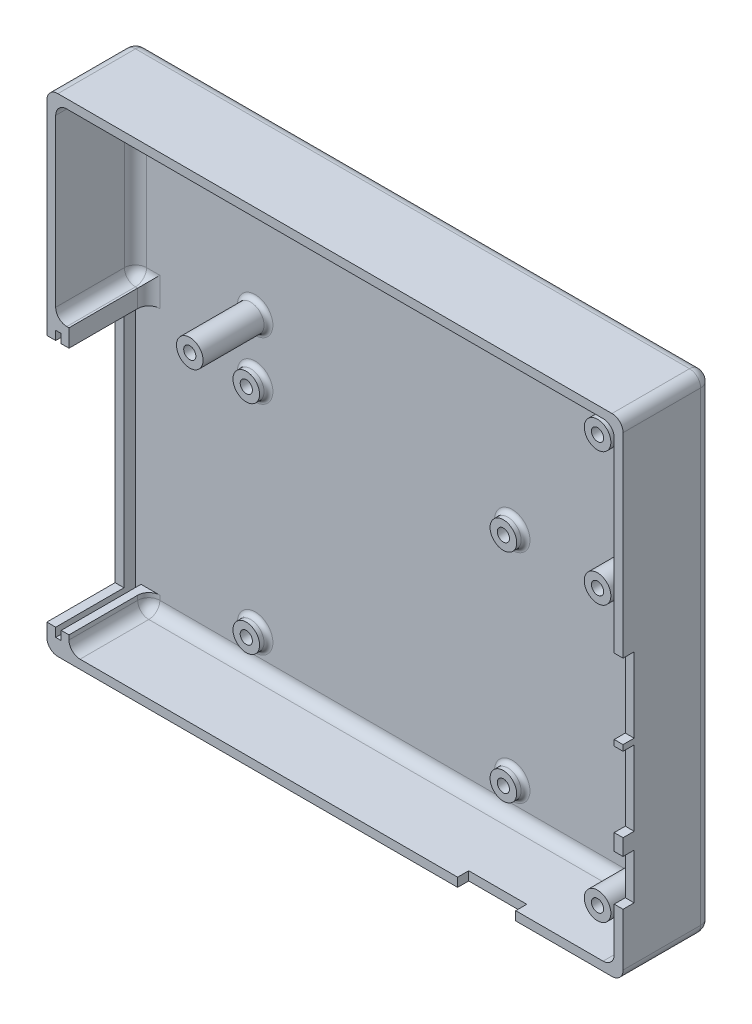
from build123d import *

# Parameters (mm, degrees)
ESQUISSE1_W             = 130
ESQUISSE1_H             = 110
BOSS_EXTRU_1_DEPTH      = 2
ESQUISSE3_R             = 3
ESQUISSE3_R_2           = 1.375
BOSS_EXTRU_2_DEPTH      = 2
ESQUISSE4_R             = 3
ESQUISSE4_R_2           = 1.375
BOSS_EXTRU_3_DEPTH      = 14.75
CONG_1_R                = 1
ESQUISSE5_W             = 130
ESQUISSE5_H             = 110
ESQUISSE5_W_2           = 126
ESQUISSE5_H_2           = 106
BOSS_EXTRU_5_DEPTH      = 18
CONG_3_R                = 2.5
ESQUISSE6_W             = 2
ESQUISSE6_H             = 10.3
ESQUISSE6_H_2           = 16.88
ESQUISSE6_W_2           = 13.1
ESQUISSE6_H_3           = 2
ENL_V_MAT_EXTRU_1_DEPTH = 2.5
ESQUISSE7_W             = 2
ESQUISSE7_H             = 56
ENL_V_MAT_EXTRU_2_DEPTH = 15.4
CONG_5_R                = 2.5
ESQUISSE9_W             = 18
ESQUISSE9_H             = 2
ESQUISSE9_H_2           = 1.5
BOSS_EXTRU_6_DEPTH      = 3
ESQUISSE11_W            = 1.75
ESQUISSE11_H            = 18
BOSS_EXTRU_7_DEPTH      = 2
ESQUISSE12_W            = 1.75
ESQUISSE12_H            = 18
BOSS_EXTRU_8_DEPTH      = 2
CONG_7_R                = 2.5
CONG_8_R                = 2.5
CONG_9_R                = 2.5


with BuildPart() as part:
    # Esquisse1 → Boss.-Extru.1 (new body)
    with BuildSketch(Plane.XY):
        with Locations((-22.737274581, 16.021428571)):
            Rectangle(ESQUISSE1_W, ESQUISSE1_H)
    extrude(amount=BOSS_EXTRU_1_DEPTH)

    # Esquisse3 → Boss.-Extru.2 (add)
    # profile 1 of 8: a face of its own
    with BuildSketch(Plane.XY.offset(2)):
        with Locations((-58.737274581, -29.978571429)):
            Circle(ESQUISSE3_R)
        with Locations((-58.737274581, -29.978571429)):
            Circle(ESQUISSE3_R_2, mode=Mode.SUBTRACT)
    # profile 2 of 8: a face of its own
    with BuildSketch(Plane.XY.offset(2)):
        with Locations((-0.737274581, -29.978571429)):
            Circle(ESQUISSE3_R)
        with Locations((-0.737274581, -29.978571429)):
            Circle(ESQUISSE3_R_2, mode=Mode.SUBTRACT)
    # profile 3 of 8: a face of its own
    with BuildSketch(Plane.XY.offset(2)):
        with Locations((33.262725419, -29.978571429)):
            Circle(ESQUISSE3_R)
        with Locations((33.262725419, -29.978571429)):
            Circle(ESQUISSE3_R_2, mode=Mode.SUBTRACT)
    # profile 4 of 8: a face of its own
    with BuildSketch(Plane.XY.offset(2)):
        with Locations((-0.737274581, 19.021428571)):
            Circle(ESQUISSE3_R)
        with Locations((-0.737274581, 19.021428571)):
            Circle(ESQUISSE3_R_2, mode=Mode.SUBTRACT)
    # profile 5 of 8: a face of its own
    with BuildSketch(Plane.XY.offset(2)):
        with Locations((33.262725419, 32.021428571)):
            Circle(ESQUISSE3_R)
        with Locations((33.262725419, 32.021428571)):
            Circle(ESQUISSE3_R_2, mode=Mode.SUBTRACT)
    # profile 6 of 8: a face of its own
    with BuildSketch(Plane.XY.offset(2)):
        with Locations((-58.737274581, 32.021428571)):
            Circle(ESQUISSE3_R)
        with Locations((-58.737274581, 32.021428571)):
            Circle(ESQUISSE3_R_2, mode=Mode.SUBTRACT)
    # profile 7 of 8: a face of its own
    with BuildSketch(Plane.XY.offset(2)):
        with Locations((-58.737274581, 19.021428571)):
            Circle(ESQUISSE3_R)
        with Locations((-58.737274581, 19.021428571)):
            Circle(ESQUISSE3_R_2, mode=Mode.SUBTRACT)
    # profile 8 of 8: a face of its own
    with BuildSketch(Plane.XY.offset(2)):
        with Locations((33.262725419, 62.021428571)):
            Circle(ESQUISSE3_R)
        with Locations((33.262725419, 62.021428571)):
            Circle(ESQUISSE3_R_2, mode=Mode.SUBTRACT)
    extrude(amount=BOSS_EXTRU_2_DEPTH)

    # Esquisse4 → Boss.-Extru.3 (add)
    # profile 1 of 4: a face of its own
    with BuildSketch(Plane.XY.offset(2)):
        with Locations((-58.737274581, 32.021428571)):
            Circle(ESQUISSE4_R)
        with Locations((-58.737274581, 32.021428571)):
            Circle(ESQUISSE4_R_2, mode=Mode.SUBTRACT)
    # profile 2 of 4: a face of its own
    with BuildSketch(Plane.XY.offset(2)):
        with Locations((33.262725419, 62.021428571)):
            Circle(ESQUISSE4_R)
        with Locations((33.262725419, 62.021428571)):
            Circle(ESQUISSE4_R_2, mode=Mode.SUBTRACT)
    # profile 3 of 4: a face of its own
    with BuildSketch(Plane.XY.offset(2)):
        with Locations((33.262725419, 32.021428571)):
            Circle(ESQUISSE4_R)
        with Locations((33.262725419, 32.021428571)):
            Circle(ESQUISSE4_R_2, mode=Mode.SUBTRACT)
    # profile 4 of 4: a face of its own
    with BuildSketch(Plane.XY.offset(2)):
        with Locations((33.262725419, -29.978571429)):
            Circle(ESQUISSE4_R)
        with Locations((33.262725419, -29.978571429)):
            Circle(ESQUISSE4_R_2, mode=Mode.SUBTRACT)
    extrude(amount=BOSS_EXTRU_3_DEPTH)

    # Congé1
    cong_1_edges = [part.edges().sort_by_distance(p)[0] for p in [
        (-61.737274581, -29.978571429, 2),
        (-3.737274581, -29.978571429, 2),
        (30.262725419, -29.978571429, 2),
        (-3.737274581, 19.021428571, 2),
        (30.262725419, 32.021428571, 2),
        (-61.737274581, 32.021428571, 2),
        (-61.737274581, 19.021428571, 2),
        (30.262725419, 62.021428571, 2),
    ]]
    fillet(cong_1_edges, radius=CONG_1_R)

    # Esquisse5 → Boss.-Extru.5 (add)
    with BuildSketch(Plane.XY.offset(2)):
        with Locations((-22.737274581, 16.021428571)):
            Rectangle(ESQUISSE5_W, ESQUISSE5_H)
        with Locations((-22.737274581, 16.021428571)):
            Rectangle(ESQUISSE5_W_2, ESQUISSE5_H_2, mode=Mode.SUBTRACT)
    extrude(amount=BOSS_EXTRU_5_DEPTH)

    # Congé3
    cong_3_edges = [part.edges().sort_by_distance(p)[0] for p in [
        (-87.737274581, 71.021428571, 10),
        (42.262725419, 71.021428571, 10),
        (42.262725419, -38.978571429, 10),
        (-87.737274581, -38.978571429, 10),
    ]]
    fillet(cong_3_edges, radius=CONG_3_R)

    # Esquisse6 → Enlèv. mat.-Extru.1 (cut)
    with BuildSketch(Plane.XY.offset(20)):
        with Locations((41.262725419, -19.438571429)):
            Rectangle(ESQUISSE6_W, ESQUISSE6_H)
        with Locations((41.262725419, -2.168571429)):
            Rectangle(ESQUISSE6_W, ESQUISSE6_H_2)
        with Locations((41.262725419, 16.021428571)):
            Rectangle(ESQUISSE6_W, ESQUISSE6_H_2)
        with Locations((11.492725419, -37.978571429)):
            Rectangle(ESQUISSE6_W_2, ESQUISSE6_H_3)
    extrude(amount=-ENL_V_MAT_EXTRU_1_DEPTH, mode=Mode.SUBTRACT)

    # Esquisse7 → Enlèv. mat.-Extru.2 (cut)
    with BuildSketch(Plane.XY.offset(20)):
        with Locations((-86.737274581, -5.478571429)):
            Rectangle(ESQUISSE7_W, ESQUISSE7_H)
    extrude(amount=-ENL_V_MAT_EXTRU_2_DEPTH, mode=Mode.SUBTRACT)

    # Congé5
    cong_5_edges = [part.edges().sort_by_distance(p)[0] for p in [
        (-22.737274581, 71.021428571, 0),
        (-87.737274581, 16.021428571, 0),
        (42.262725419, 16.021428571, 0),
        (-22.737274581, -38.978571429, 0),
        (-87.005041533, 70.289195524, 0),
        (-87.005041533, -38.246338382, 0),
        (41.530492372, -38.246338382, 0),
        (41.530492372, 70.289195524, 0),
    ]]
    fillet(cong_5_edges, radius=CONG_5_R)

    # Esquisse9 → Boss.-Extru.6 (add)
    with BuildSketch(Plane(origin=(-85.737274581, 0, 0), x_dir=(0, 0, -1), z_dir=(1, 0, 0))):
        with Locations((-11, 25.521428571)):
            Rectangle(ESQUISSE9_W, ESQUISSE9_H)
        with Locations((-11, -36.228571429)):
            Rectangle(ESQUISSE9_W, ESQUISSE9_H_2)
    extrude(amount=BOSS_EXTRU_6_DEPTH)

    # Esquisse11 → Boss.-Extru.7 (add)
    with BuildSketch(Plane.XZ.offset(-24.521428571)):
        with Locations((-83.612274581, 11)):
            Rectangle(ESQUISSE11_W, ESQUISSE11_H)
    extrude(amount=BOSS_EXTRU_7_DEPTH)

    # Esquisse12 → Boss.-Extru.8 (add)
    with BuildSketch(Plane(origin=(0, -35.478571429, 0), x_dir=(1, 0, 0), z_dir=(0, 1, 0))):
        with Locations((-83.612274581, -11)):
            Rectangle(ESQUISSE12_W, ESQUISSE12_H)
    extrude(amount=BOSS_EXTRU_8_DEPTH)

    # Congé7
    cong_7_edges = [part.edges().sort_by_distance(p)[0] for p in [
        (40.262725419, -36.978571429, 11),
        (40.262725419, 69.021428571, 11),
        (-85.737274581, 69.021428571, 11),
        (-85.737274581, 26.521428571, 11),
        (-82.737274581, -36.978571429, 11),
    ]]
    fillet(cong_7_edges, radius=CONG_7_R)

    # Congé8
    cong_8_edges = [part.edges().sort_by_distance(p)[0] for p in [
        (-82.737274581, -33.978571429, 2),
        (-82.005041533, -36.246338382, 2),
        (-21.237274581, -36.978571429, 2),
        (39.530492372, -36.246338382, 2),
        (40.262725419, 16.021428571, 2),
        (39.530492372, 68.289195524, 2),
        (-22.737274581, 69.021428571, 2),
        (-85.005041533, 68.289195524, 2),
        (-82.987274581, 26.521428571, 2),
        (-85.005041533, 27.253661618, 2),
        (-85.737274581, 47.771428571, 2),
    ]]
    fillet(cong_8_edges, radius=CONG_8_R)

    # Congé9
    cong_9_edges = [part.edges().sort_by_distance(p)[0] for p in [
        (-82.737274581, 25.771428571, 2),
    ]]
    fillet(cong_9_edges, radius=CONG_9_R)


solid = part.part
